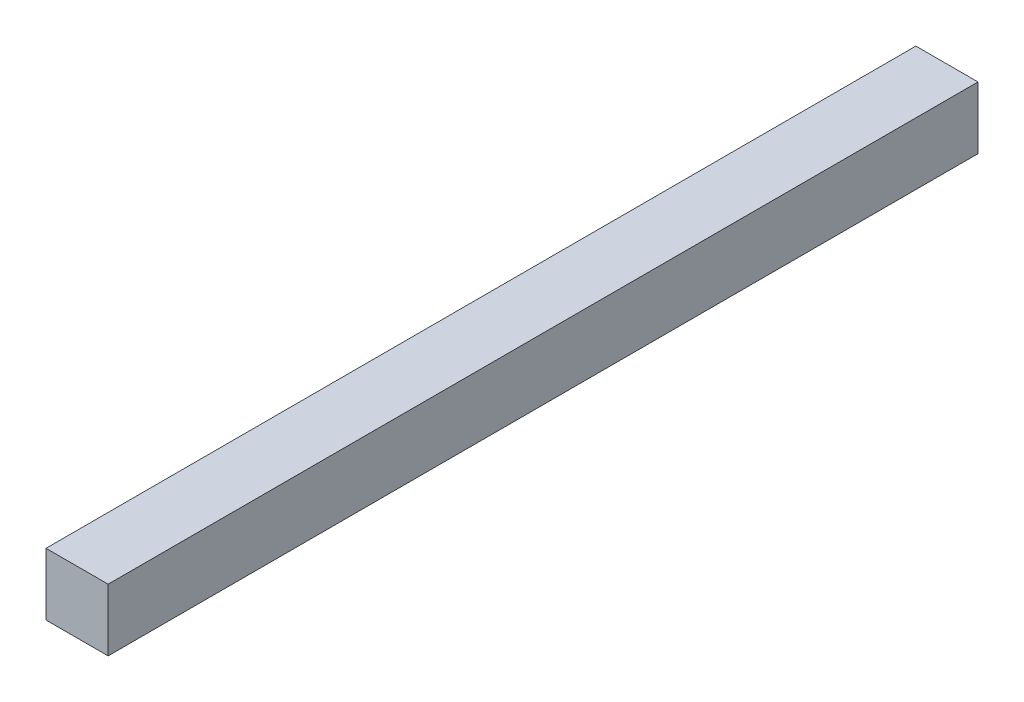
from build123d import *

# Parameters (mm, degrees)
SKETCH1_W           = 9.525
SKETCH1_H           = 9.525
BOSS_EXTRUDE1_DEPTH = 133.35


with BuildPart() as part:
    # Sketch1 → Boss-Extrude1 (new body)
    with BuildSketch(Plane.XY):
        with Locations((4.7625, 4.7625)):
            Rectangle(SKETCH1_W, SKETCH1_H)
    extrude(amount=BOSS_EXTRUDE1_DEPTH)


solid = part.part
